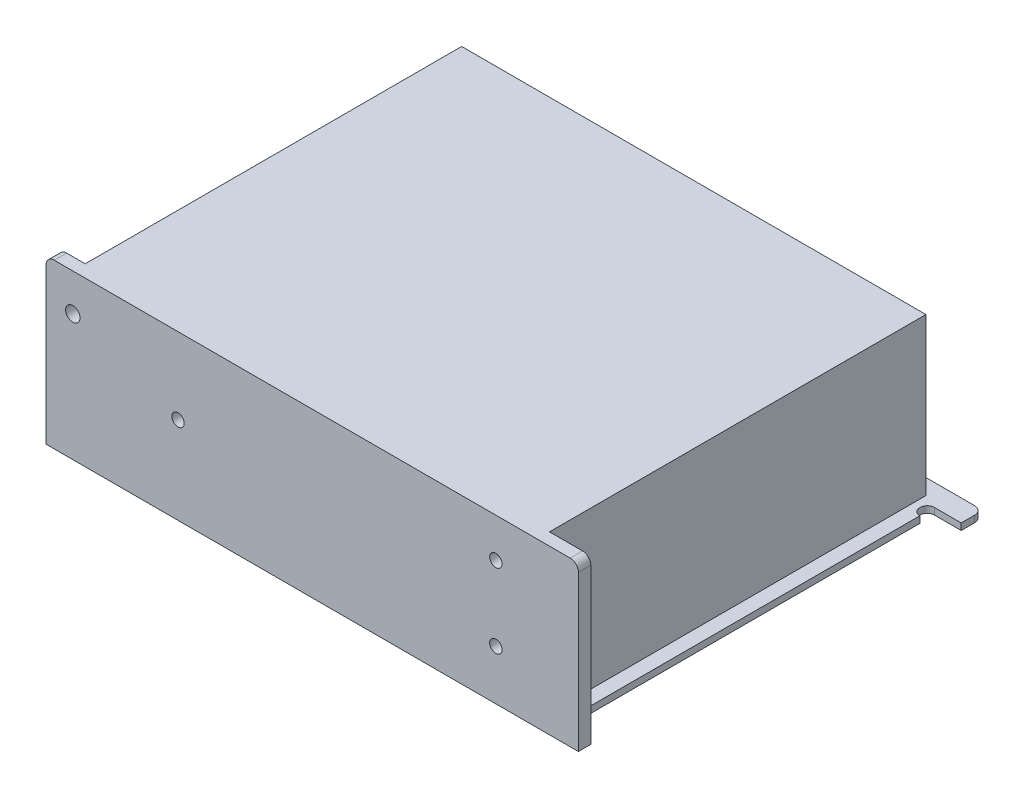
from build123d import *

# Parameters (mm, degrees)
BOSS_EXTRUDE1_DEPTH = 1.6
SKETCH2_W           = 112.5
SKETCH2_H           = 91.209934792
BOSS_EXTRUDE2_DEPTH = 38
SKETCH3_W           = 129
SKETCH3_H           = 3
BOSS_EXTRUDE3_DEPTH = 38
SKETCH4_R           = 1.5
SKETCH4_R_2         = 1.75
CUT_EXTRUDE1_DEPTH  = 4
SKETCH5_R           = 1.75
SKETCH5_R_2         = 1.5
CUT_EXTRUDE2_DEPTH  = 4
FILLET1_R           = 2
FILLET2_R           = 2
FILLET3_R           = 2


with BuildPart() as part:
    # Sketch1 → Boss-Extrude1 (new body)
    with BuildSketch(Plane(origin=(0, 0, 0), x_dir=(1, 0, 0), z_dir=(0, 1, 0))):
        with BuildLine():
            Line((-68.019736842, 49), (-68.019736842, -49))
            Line((-68.019736842, -49), (60.980263158, -49))
            Line((60.980263158, -49), (60.980263158, -46))
            Line((60.980263158, -46), (54.480263158, -46))
            Line((54.480263158, -46), (54.480263158, 40.25))
            ThreePointArc((54.480263158, 40.25), (52.730263158, 42), (54.480263158, 43.75))
            Line((54.480263158, 43.75), (60.980263158, 43.75))
            Line((60.980263158, 43.75), (60.980263158, 49))
            Line((60.980263158, 49), (-68.019736842, 49))
        make_face()
    extrude(amount=BOSS_EXTRUDE1_DEPTH)

    # Sketch2 → Boss-Extrude2 (add)
    with BuildSketch(Plane(origin=(0, 1.6, 0), x_dir=(1, 0, 0), z_dir=(0, 1, 0))):
        with Locations((-5.269736842, -0.395032604)):
            Rectangle(SKETCH2_W, SKETCH2_H)
    extrude(amount=BOSS_EXTRUDE2_DEPTH)

    # Sketch3 → Boss-Extrude3 (add)
    with BuildSketch(Plane(origin=(0, 1.6, 0), x_dir=(1, 0, 0), z_dir=(0, 1, 0))):
        with Locations((-3.519736842, -47.5)):
            Rectangle(SKETCH3_W, SKETCH3_H)
    extrude(amount=BOSS_EXTRUDE3_DEPTH)

    # Sketch4 → Cut-Extrude1 (cut)
    with BuildSketch(Plane.XY.offset(49)):
        with Locations((-36.019736842, 21.1)):
            Circle(SKETCH4_R)
        with Locations((40.980263158, 12.1)):
            Circle(SKETCH4_R)
        with Locations((40.980263158, 30.1)):
            Circle(SKETCH4_R)
        with Locations((-61.519736842, 30.6)):
            Circle(SKETCH4_R_2)
    extrude(amount=-CUT_EXTRUDE1_DEPTH, mode=Mode.SUBTRACT)

    # Sketch5 → Cut-Extrude2 (cut)
    with BuildSketch(Plane.XZ):
        with Locations(Location((-63.519736842, 43.5, 0), (0, 0, 270))):
            Circle(SKETCH5_R)
        with Locations(Location((9.980263158, 18, 0), (0, 0, 270))):
            Circle(SKETCH5_R_2)
        with Locations(Location((9.980263158, -15, 0), (0, 0, 270))):
            Circle(SKETCH5_R_2)
    extrude(amount=-CUT_EXTRUDE2_DEPTH, mode=Mode.SUBTRACT)

    # Fillet1
    fillet1_edges = [part.edges().sort_by_distance(p)[0] for p in [
        (60.980263158, 0.8, -49),
    ]]
    fillet(fillet1_edges, radius=FILLET1_R)

    # Fillet2
    fillet2_edges = [part.edges().sort_by_distance(p)[0] for p in [
        (60.980263158, 39.6, 47.5),
    ]]
    fillet(fillet2_edges, radius=FILLET2_R)

    # Fillet3
    fillet3_edges = [part.edges().sort_by_distance(p)[0] for p in [
        (-68.019736842, 39.6, 47.5),
    ]]
    fillet(fillet3_edges, radius=FILLET3_R)


solid = part.part
